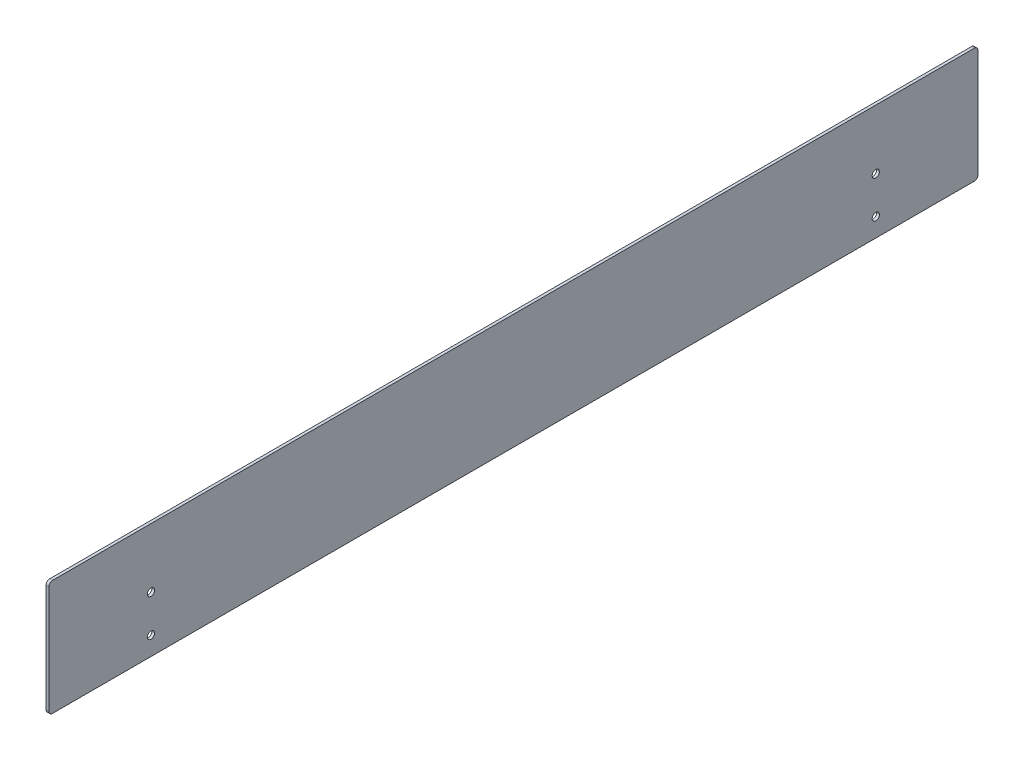
from build123d import *

# Parameters (mm, degrees)
SKETCH1_W           = 500
SKETCH1_H           = 62
SKETCH1_R           = 1.95
BOSS_EXTRUDE1_DEPTH = 1.5
FILLET1_R           = 2


with BuildPart() as part:
    # Sketch1 → Boss-Extrude1 (new body)
    with BuildSketch(Plane(origin=(0, 0, 0), x_dir=(0, 0, -1), z_dir=(1, 0, 0))):
        with Locations((-36.339345362, -109.292553191)):
            Rectangle(SKETCH1_W, SKETCH1_H)
        with Locations((158.660654638, -110.292553191)):
            Circle(SKETCH1_R, mode=Mode.SUBTRACT)
        with Locations((158.660654638, -130.292553191)):
            Circle(SKETCH1_R, mode=Mode.SUBTRACT)
        with Locations((-231.339345362, -110.292553191)):
            Circle(SKETCH1_R, mode=Mode.SUBTRACT)
        with Locations((-231.339345362, -130.292553191)):
            Circle(SKETCH1_R, mode=Mode.SUBTRACT)
    extrude(amount=BOSS_EXTRUDE1_DEPTH)

    # Fillet1
    fillet1_edges = [part.edges().sort_by_distance(p)[0] for p in [
        (0.75, -78.292553191, 286.339345362),
        (0.75, -78.292553191, -213.660654638),
        (0.75, -140.292553191, -213.660654638),
        (0.75, -140.292553191, 286.339345362),
    ]]
    fillet(fillet1_edges, radius=FILLET1_R)


solid = part.part
